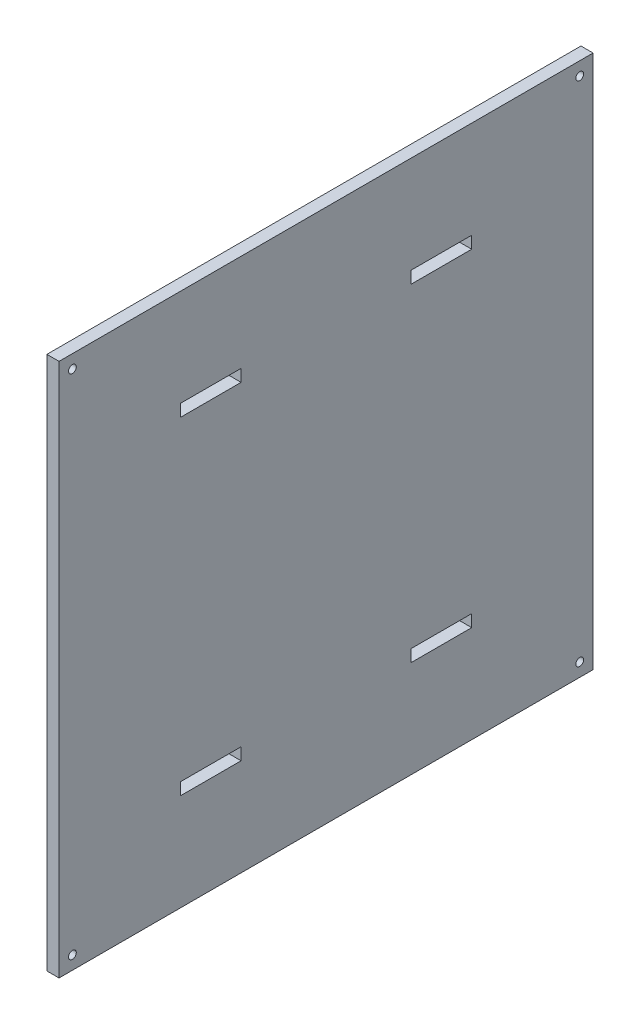
from build123d import *

# Parameters (mm, degrees)
SKETCH_1_W      = 220
SKETCH_1_H      = 220
SKETCH_1_R      = 1.6
SKETCH_1_W_2    = 25
SKETCH_1_H_2    = 5
EXTRUDE_1_DEPTH = 5


with BuildPart() as part:
    # 草图1 → 凸台-拉伸1 (new body)
    with BuildSketch(Plane(origin=(0, 0, 0), x_dir=(0, 0, -1), z_dir=(1, 0, 0))):
        with Locations((-110, 110)):
            Rectangle(SKETCH_1_W, SKETCH_1_H)
        with Locations((-214.5, 214.5)):
            Circle(SKETCH_1_R, mode=Mode.SUBTRACT)
        with Locations((-5.5, 214.5)):
            Circle(SKETCH_1_R, mode=Mode.SUBTRACT)
        with Locations((-214.5, 5.5)):
            Circle(SKETCH_1_R, mode=Mode.SUBTRACT)
        with Locations((-5.5, 5.5)):
            Circle(SKETCH_1_R, mode=Mode.SUBTRACT)
        with Locations((-157.5, 42.5)):
            Rectangle(SKETCH_1_W_2, SKETCH_1_H_2, mode=Mode.SUBTRACT)
        with Locations((-62.5, 42.5)):
            Rectangle(SKETCH_1_W_2, SKETCH_1_H_2, mode=Mode.SUBTRACT)
        with Locations((-157.5, 177.5)):
            Rectangle(SKETCH_1_W_2, SKETCH_1_H_2, mode=Mode.SUBTRACT)
        with Locations((-62.5, 177.5)):
            Rectangle(SKETCH_1_W_2, SKETCH_1_H_2, mode=Mode.SUBTRACT)
    extrude(amount=EXTRUDE_1_DEPTH)


solid = part.part
